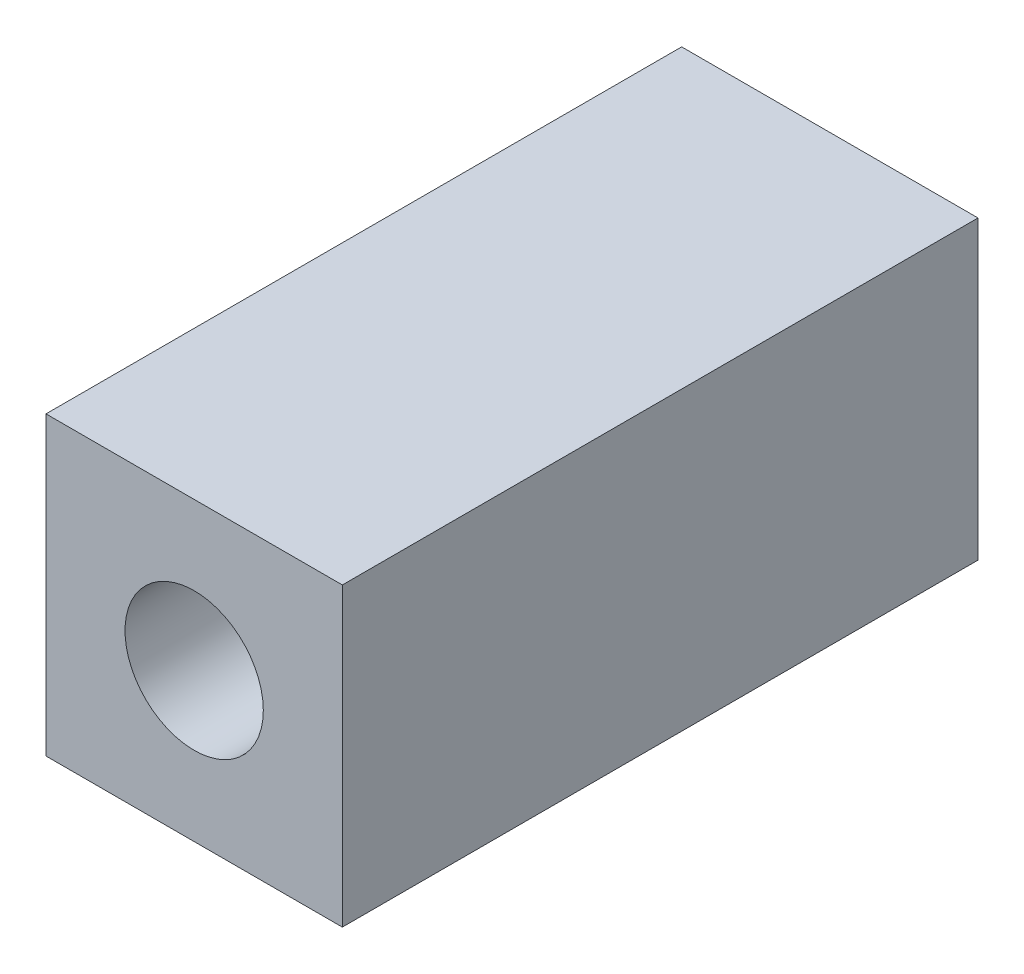
from build123d import *

# Parameters (mm, degrees)
SKETCH1_W           = 6
SKETCH1_H           = 6
SKETCH1_R           = 1.4
BOSS_EXTRUDE1_DEPTH = 12.87


with BuildPart() as part:
    # Sketch1 → Boss-Extrude1 (new body)
    with BuildSketch(Plane.XY):
        Rectangle(SKETCH1_W, SKETCH1_H)
        Circle(SKETCH1_R, mode=Mode.SUBTRACT)
    extrude(amount=BOSS_EXTRUDE1_DEPTH)


solid = part.part
